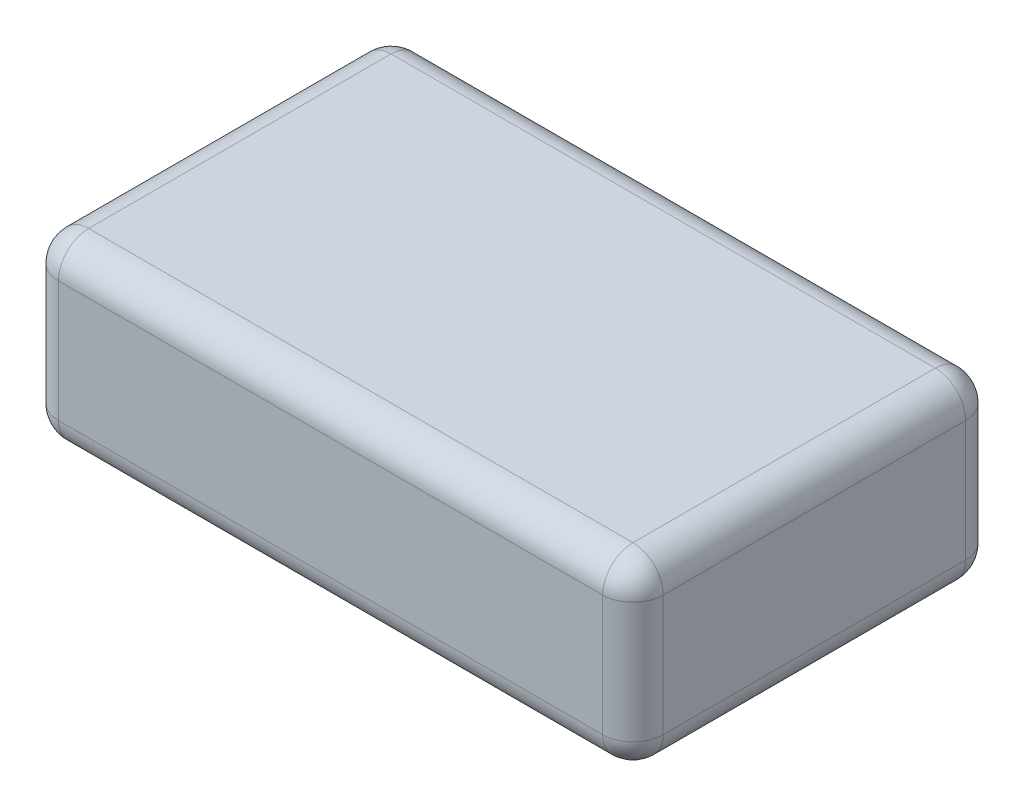
from build123d import *

# Parameters (mm, degrees)
SKETCH1_W           = 200
SKETCH1_H           = 120
BOSS_EXTRUDE1_DEPTH = 60
FILLET1_R           = 10


with BuildPart() as part:
    # Sketch1 → Boss-Extrude1 (new body)
    with BuildSketch(Plane(origin=(0, 0, 0), x_dir=(1, 0, 0), z_dir=(0, 1, 0))):
        Rectangle(SKETCH1_W, SKETCH1_H)
    extrude(amount=BOSS_EXTRUDE1_DEPTH)

    # Fillet1
    fillet1_edges = [part.edges().sort_by_distance(p)[0] for p in [
        (-100, 60, 0),
        (0, 60, 60),
        (100, 60, 0),
        (0, 0, 60),
        (-100, 0, 0),
        (0, 0, -60),
        (100, 0, 0),
        (100, 30, 60),
        (-100, 30, 60),
        (-100, 30, -60),
        (100, 30, -60),
        (0, 60, -60),
    ]]
    fillet(fillet1_edges, radius=FILLET1_R)


solid = part.part
